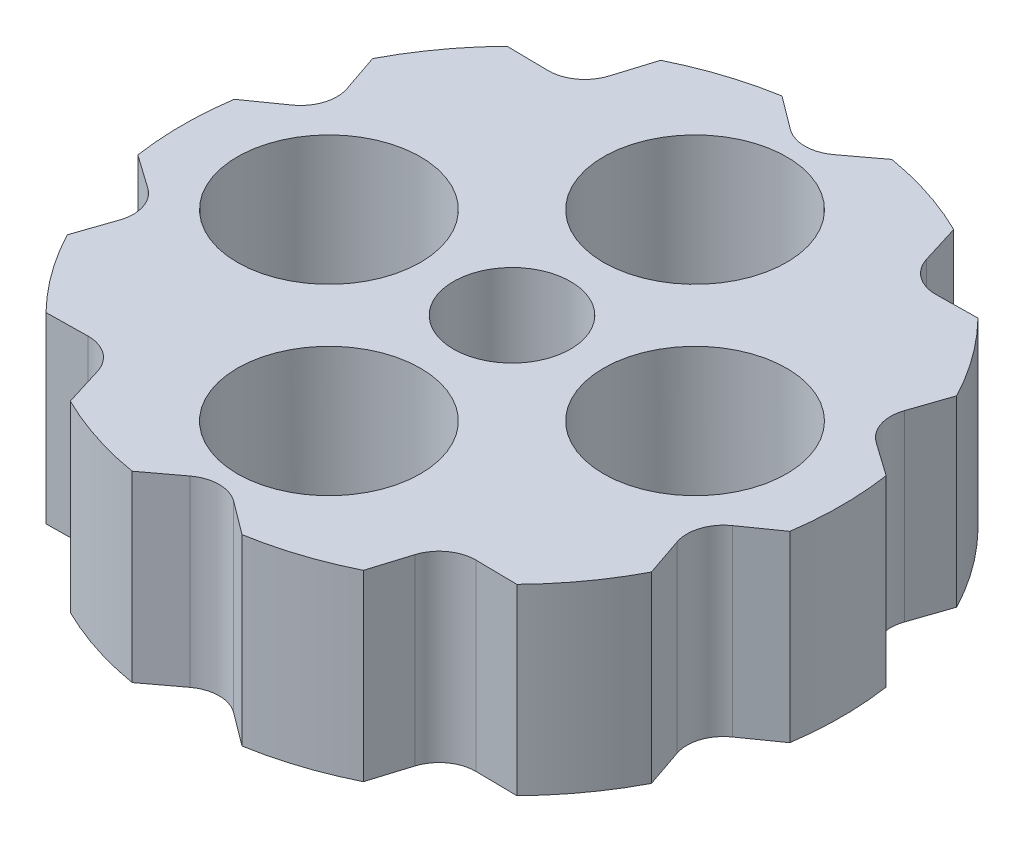
from build123d import *

# Parameters (mm, degrees)
SKETCH_1_R               = 9
SKETCH_1_R_2             = 1.6
EXTRUDE_1_DEPTH          = 5
CUT_EXTRUDE_2_REACH      = 15.675
PATTERN_CIRCULAR_1_COUNT = 10
CUT_EXTRUDE_1_REACH      = 15.592
SKETCH_3_R               = 2.5
PATTERN_CIRCULAR_2_COUNT = 4


with BuildPart() as part:
    # 草图1 → 凸台-拉伸1 (new body)
    with BuildSketch(Plane(origin=(0, 0, 0), x_dir=(1, 0, 0), z_dir=(0, 1, 0))):
        with Locations(Location((0, 0, 0), (0, 0, 270))):
            Circle(SKETCH_1_R)
        with Locations(Location((0, 0, 0), (0, 0, 270))):
            Circle(SKETCH_1_R_2, mode=Mode.SUBTRACT)
    extrude(amount=EXTRUDE_1_DEPTH)

    # 草图4 → 切除-拉伸2 (cut, up to next)
    with BuildSketch(Plane(origin=(0, 5, 0), x_dir=(1, 0, 0), z_dir=(0, 1, 0)), mode=Mode.PRIVATE) as cut_extrude_2_sk1:
        with BuildLine():
            Line((-1.5, 8.874119675), (-0.599498979, 8.19962448))
            ThreePointArc((-0.599498979, 8.19962448), (0, 8), (0.599498979, 8.19962448))
            Line((0.599498979, 8.19962448), (1.5, 8.874119675))
            ThreePointArc((1.5, 8.874119675), (0, 9), (-1.5, 8.874119675))
        make_face()
    cut_extrude_2_tool1 = extrude(cut_extrude_2_sk1.sketch, amount=-CUT_EXTRUDE_2_REACH, mode=Mode.PRIVATE) & part.part
    cut_extrude_2 = cut_extrude_2_tool1.solids().sort_by_distance((0, 5, -8.590322))[0]
    add(cut_extrude_2, mode=Mode.SUBTRACT)

    # 阵列(圆周)1: 切除-拉伸2 ×10 about axis
    pattern_circular_1_axis = Axis((0, 0, 0), (0, 1, 0))
    for i in range(1, PATTERN_CIRCULAR_1_COUNT):
        add(cut_extrude_2.rotate(pattern_circular_1_axis, i * 360 / PATTERN_CIRCULAR_1_COUNT), mode=Mode.SUBTRACT)

    # 草图3 → 切除-拉伸1 (cut, up to next)
    with BuildSketch(Plane(origin=(0, 5, 0), x_dir=(1, 0, 0), z_dir=(0, 1, 0)), mode=Mode.PRIVATE) as cut_extrude_1_sk1:
        with Locations(Location((0, 5, 0), (0, 0, 270))):
            Circle(SKETCH_3_R)
    cut_extrude_1_tool1 = extrude(cut_extrude_1_sk1.sketch, amount=-CUT_EXTRUDE_1_REACH, mode=Mode.PRIVATE) & part.part
    cut_extrude_1 = cut_extrude_1_tool1.solids().sort_by_distance((0, 5, -5))[0]
    add(cut_extrude_1, mode=Mode.SUBTRACT)

    # 阵列(圆周)2: 切除-拉伸1 ×4 about axis
    pattern_circular_2_axis = Axis((0, 0, 0), (0, 1, 0))
    for i in range(1, PATTERN_CIRCULAR_2_COUNT):
        add(cut_extrude_1.rotate(pattern_circular_2_axis, i * 360 / PATTERN_CIRCULAR_2_COUNT), mode=Mode.SUBTRACT)


solid = part.part
